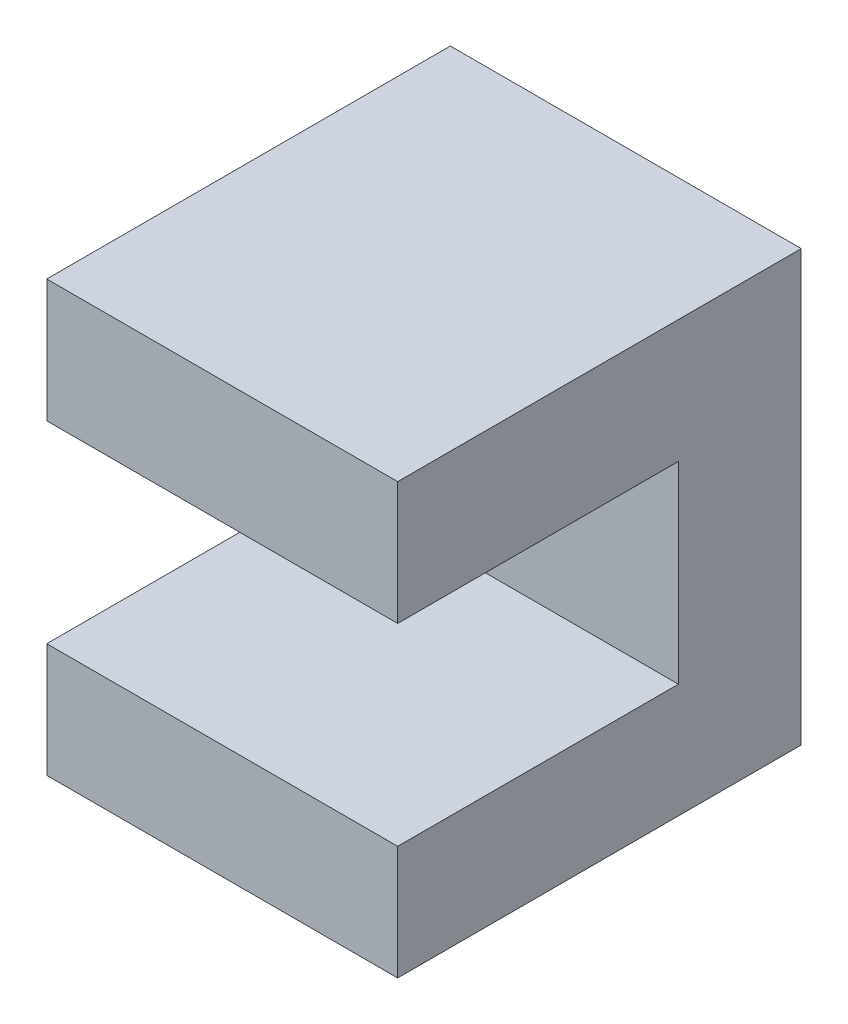
from build123d import *

# Parameters (mm, degrees)
SKETCH1_W           = 7
SKETCH1_H           = 11
SKETCH1_W_2         = 23
SKETCH1_H_2         = 6.5
BOSS_EXTRUDE1_DEPTH = 20


with BuildPart() as part:
    # Sketch1 → Boss-Extrude1 (new body)
    with BuildSketch(Plane(origin=(0, 0, 0), x_dir=(0, 0, -1), z_dir=(1, 0, 0))):
        with Locations((-3.5, 12)):
            Rectangle(SKETCH1_W, SKETCH1_H)
        Polygon((-7, 17.5), (0, 17.5), (0, 24.5), (-23, 24.5), (-23, 19.5), (-23, 17.5), align=None)
        with Locations((-11.5, 3.25)):
            Rectangle(SKETCH1_W_2, SKETCH1_H_2)
    extrude(amount=BOSS_EXTRUDE1_DEPTH)


solid = part.part
